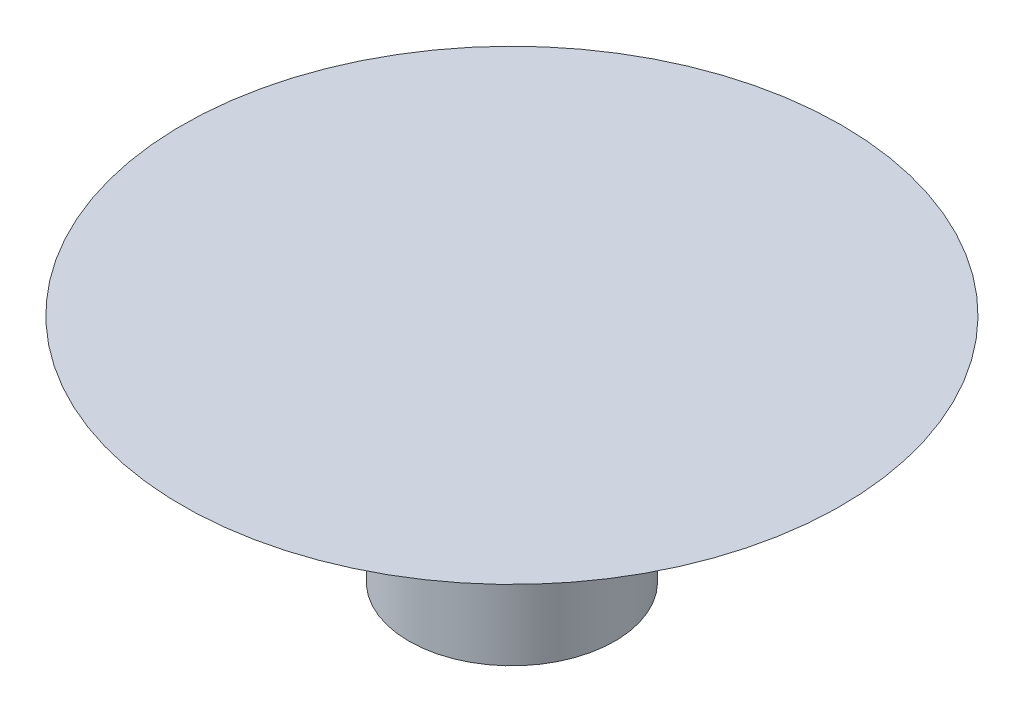
from build123d import *

# Parameters (mm, degrees)
SKETCH_2_R      = 1.25
EXTRUDE_1_DEPTH = 1.8


with BuildPart() as part:
    # Эскиз2 → Бобышка-Вытянуть1 (new body)
    with BuildSketch(Plane(origin=(0, 0, 0), x_dir=(1, 0, 0), z_dir=(0, 1, 0))):
        with Locations(Location((0, 0, 0), (0, 0, 270))):
            Circle(SKETCH_2_R)
    extrude(amount=-EXTRUDE_1_DEPTH)

    # Эскиз4 → Повернуть1 (revolve)
    with BuildSketch(Plane.XY, mode=Mode.PRIVATE) as revolve_1_sk:
        with BuildLine():
            Line((0, 0), (0, 1))
            Line((0, 1), (4, 1))
            ThreePointArc((4, 1), (3.323810781, 0.850092459), (2.774328891, 0.428460175))
            Line((2.774328891, 0.428460175), (2.654597544, 0.285769912))
            ThreePointArc((2.654597544, 0.285769912), (2.379856599, 0.07495377), (2.041761989, 0))
            Line((2.041761989, 0), (1.25, 0))
            Line((1.25, 0), (0, 0))
        make_face()
    revolve(revolve_1_sk.sketch.rotate(Axis((0, 0, 0), (0, 1, 0)), 90), axis=Axis((0, 0, 0), (0, 1, 0)))


solid = part.part
